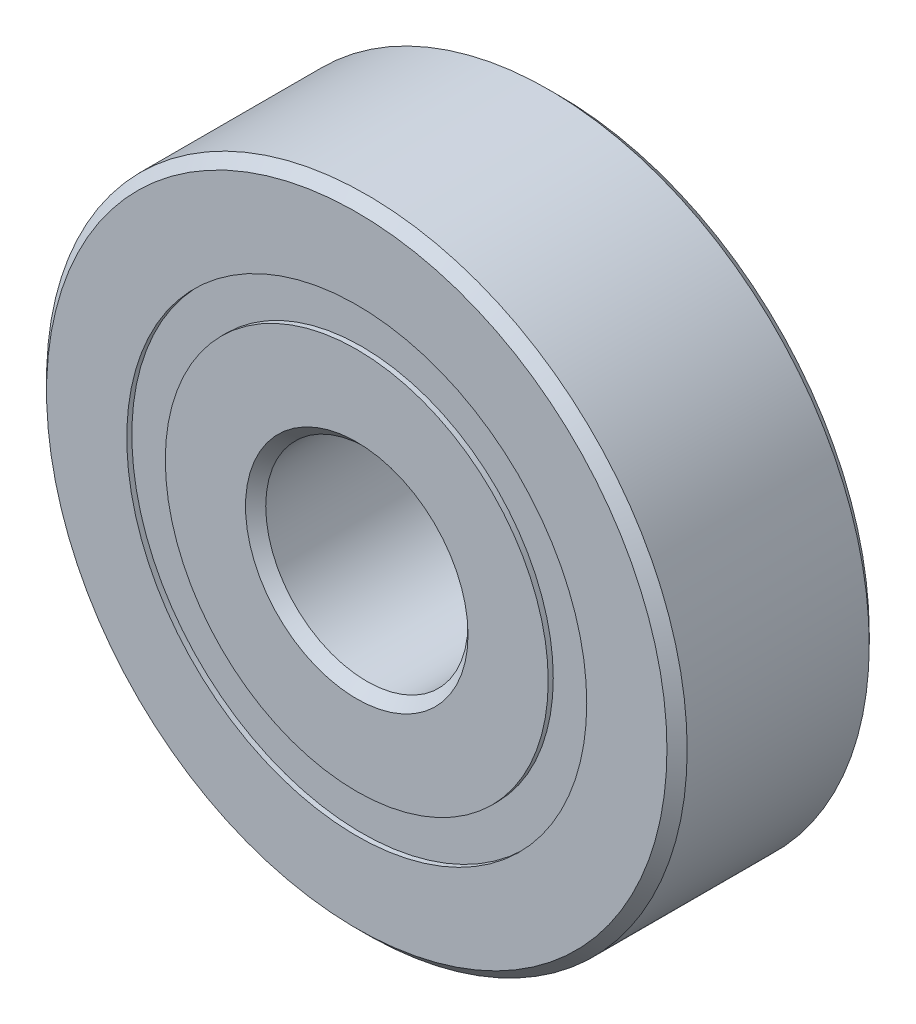
from build123d import *

# Parameters (mm, degrees)
CIRPATTERN1_COUNT = 14
SKETCH6_W         = 1.399376551
SKETCH6_H         = 1.142857142


with BuildPart() as part:
    # Sketch1 → Revolve1 (revolve)
    with BuildSketch(Plane(origin=(0, 0, 0), x_dir=(0, 0, -1), z_dir=(1, 0, 0))):
        with BuildLine():
            Line((2.7, 9.5), (-2.7, 9.5))
            Line((-2.7, 9.5), (-3, 9.2))
            Line((-3, 9.2), (-3, 6.821428571))
            Line((-3, 6.821428571), (-1.333333333, 6.821428571))
            ThreePointArc((-1.333333333, 6.821428571), (0, 7.700623449), (1.333333333, 6.821428571))
            Line((1.333333333, 6.821428571), (3, 6.821428571))
            Line((3, 6.821428571), (3, 9.2))
            Line((3, 9.2), (2.7, 9.5))
        make_face()
    revolve(axis=Axis((0, 0, 3), (0, 0, -1)))


with BuildPart() as body_2:
    # Sketch3 → Revolve3 (revolve)
    with BuildSketch(Plane(origin=(0, 0, 0), x_dir=(0, 0, -1), z_dir=(1, 0, 0))):
        with BuildLine():
            Line((-3, 5.678571429), (-1.333333333, 5.678571429))
            ThreePointArc((-1.333333333, 5.678571429), (0, 4.799376551), (1.333333333, 5.678571429))
            Line((1.333333333, 5.678571429), (3, 5.678571429))
            Line((3, 5.678571429), (3, 3.3))
            Line((3, 3.3), (2.7, 3))
            Line((2.7, 3), (-2.7, 3))
            Line((-2.7, 3), (-3, 3.3))
            Line((-3, 3.3), (-3, 5.678571429))
        make_face()
    revolve(axis=Axis((0, 0, 3), (0, 0, -1)))


with BuildPart() as body_3:
    # Sketch4 → Revolve4 (revolve)
    with BuildSketch(Plane(origin=(0, 0, 0), x_dir=(0, 0, -1), z_dir=(1, 0, 0))):
        with BuildLine():
            Line((-1.450623449, 6.25), (1.450623449, 6.25))
            ThreePointArc((1.450623449, 6.25), (0, 7.700623449), (-1.450623449, 6.25))
        make_face()
    revolve(axis=Axis((0, 6.25, 1.450623449), (0, 0, -1)))


with BuildPart() as cirpattern1_1:
    # CirPattern1: pattern copy
    add(body_3.part.rotate(Axis((0, 0, -3), (0, 0, 1)), 1 * 360 / CIRPATTERN1_COUNT))


with BuildPart() as cirpattern1_2:
    # CirPattern1: pattern copy
    add(body_3.part.rotate(Axis((0, 0, -3), (0, 0, 1)), 2 * 360 / CIRPATTERN1_COUNT))


with BuildPart() as cirpattern1_3:
    # CirPattern1: pattern copy
    add(body_3.part.rotate(Axis((0, 0, -3), (0, 0, 1)), 3 * 360 / CIRPATTERN1_COUNT))


with BuildPart() as cirpattern1_4:
    # CirPattern1: pattern copy
    add(body_3.part.rotate(Axis((0, 0, -3), (0, 0, 1)), 4 * 360 / CIRPATTERN1_COUNT))


with BuildPart() as cirpattern1_5:
    # CirPattern1: pattern copy
    add(body_3.part.rotate(Axis((0, 0, -3), (0, 0, 1)), 5 * 360 / CIRPATTERN1_COUNT))


with BuildPart() as cirpattern1_6:
    # CirPattern1: pattern copy
    add(body_3.part.rotate(Axis((0, 0, -3), (0, 0, 1)), 6 * 360 / CIRPATTERN1_COUNT))


with BuildPart() as cirpattern1_7:
    # CirPattern1: pattern copy
    add(body_3.part.rotate(Axis((0, 0, -3), (0, 0, 1)), 7 * 360 / CIRPATTERN1_COUNT))


with BuildPart() as cirpattern1_8:
    # CirPattern1: pattern copy
    add(body_3.part.rotate(Axis((0, 0, -3), (0, 0, 1)), 8 * 360 / CIRPATTERN1_COUNT))


with BuildPart() as cirpattern1_9:
    # CirPattern1: pattern copy
    add(body_3.part.rotate(Axis((0, 0, -3), (0, 0, 1)), 9 * 360 / CIRPATTERN1_COUNT))


with BuildPart() as cirpattern1_10:
    # CirPattern1: pattern copy
    add(body_3.part.rotate(Axis((0, 0, -3), (0, 0, 1)), 10 * 360 / CIRPATTERN1_COUNT))


with BuildPart() as cirpattern1_11:
    # CirPattern1: pattern copy
    add(body_3.part.rotate(Axis((0, 0, -3), (0, 0, 1)), 11 * 360 / CIRPATTERN1_COUNT))


with BuildPart() as cirpattern1_12:
    # CirPattern1: pattern copy
    add(body_3.part.rotate(Axis((0, 0, -3), (0, 0, 1)), 12 * 360 / CIRPATTERN1_COUNT))


with BuildPart() as cirpattern1_13:
    # CirPattern1: pattern copy
    add(body_3.part.rotate(Axis((0, 0, -3), (0, 0, 1)), 13 * 360 / CIRPATTERN1_COUNT))


with BuildPart() as body_17:
    # Sketch6 → Revolve5 (revolve)
    with BuildSketch(Plane(origin=(0, 0, 0), x_dir=(0, 0, -1), z_dir=(1, 0, 0))):
        with Locations((-2.150311724, 6.25)):
            Rectangle(SKETCH6_W, SKETCH6_H)
        with Locations((2.150311724, 6.25)):
            Rectangle(SKETCH6_W, SKETCH6_H)
    revolve(axis=Axis((0, 0, 3), (0, 0, -1)))


solid = Compound([part.part, body_2.part, body_3.part, cirpattern1_1.part, cirpattern1_2.part, cirpattern1_3.part, cirpattern1_4.part, cirpattern1_5.part, cirpattern1_6.part, cirpattern1_7.part, cirpattern1_8.part, cirpattern1_9.part, cirpattern1_10.part, cirpattern1_11.part, cirpattern1_12.part, cirpattern1_13.part, body_17.part])
